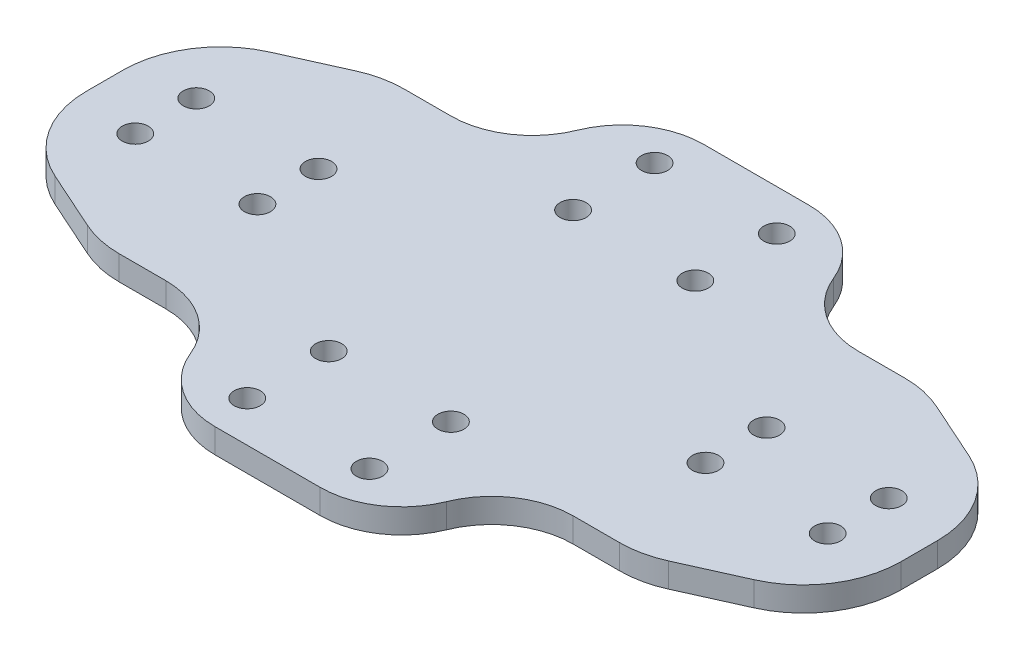
from build123d import *

# Parameters (mm, degrees)
SKETCH_2_W          = 30
SKETCH_2_H          = 60
SKETCH_2_R          = 1.6
EXTRUDE_1_DEPTH     = 3
SKETCH_3_W          = 100
SKETCH_3_H          = 35
SKETCH_3_W_2        = 28.612944684
SKETCH_3_H_2        = 33.572555392
EXTRUDE_2_DEPTH     = 3
SKETCH_4_R          = 1.6
CUT_EXTRUDE_1_DEPTH = 59.386642308
SKETCH_6_OUTSIDE_W  = 125.332
SKETCH_6_OUTSIDE_H  = 85.332
CUT_EXTRUDE_2_DEPTH = 59.386642308
FILLET_3_R          = 10
FILLET_4_R          = 10
FILLET_5_R          = 12
FILLET_6_R          = 12


with BuildPart() as part:
    # 草图2 → 凸台-拉伸1 (new body)
    with BuildSketch(Plane(origin=(0, 0, 0), x_dir=(1, 0, 0), z_dir=(0, 1, 0))):
        Rectangle(SKETCH_2_W, SKETCH_2_H)
        with Locations(Location((-7.5, -15, 0), (0, 0, 270))):
            Circle(SKETCH_2_R, mode=Mode.SUBTRACT)
        with Locations(Location((7.5, -15, 0), (0, 0, 270))):
            Circle(SKETCH_2_R, mode=Mode.SUBTRACT)
        with Locations(Location((7.5, 15, 0), (0, 0, 270))):
            Circle(SKETCH_2_R, mode=Mode.SUBTRACT)
        with Locations(Location((7.5, 25, 0), (0, 0, 270))):
            Circle(SKETCH_2_R, mode=Mode.SUBTRACT)
        with Locations(Location((-7.5, 15, 0), (0, 0, 270))):
            Circle(SKETCH_2_R, mode=Mode.SUBTRACT)
        with Locations(Location((-7.5, 25, 0), (0, 0, 270))):
            Circle(SKETCH_2_R, mode=Mode.SUBTRACT)
        with Locations(Location((7.5, -25, 0), (0, 0, 270))):
            Circle(SKETCH_2_R, mode=Mode.SUBTRACT)
        with Locations(Location((-7.5, -25, 0), (0, 0, 270))):
            Circle(SKETCH_2_R, mode=Mode.SUBTRACT)
    extrude(amount=EXTRUDE_1_DEPTH)

    # 草图3 → 凸台-拉伸2 (add)
    with BuildSketch(Plane.XZ):
        Rectangle(SKETCH_3_W, SKETCH_3_H)
        Rectangle(SKETCH_3_W_2, SKETCH_3_H_2, mode=Mode.SUBTRACT)
    extrude(amount=-EXTRUDE_2_DEPTH)

    # 草图4 → 切除-拉伸1 (cut, through all)
    with BuildSketch(Plane.XZ):
        with Locations(Location((-42.5, 3.75, 0), (0, 0, 270))):
            Circle(SKETCH_4_R)
        with Locations(Location((-42.5, -3.75, 0), (0, 0, 90))):
            Circle(SKETCH_4_R)
        with Locations(Location((-27.5, -3.75, 0), (0, 0, 270))):
            Circle(SKETCH_4_R)
        with Locations(Location((-27.5, 3.75, 0), (0, 0, 90))):
            Circle(SKETCH_4_R)
        with Locations(Location((42.5, 3.75, 0), (0, 0, 90))):
            Circle(SKETCH_4_R)
        with Locations(Location((42.5, -3.75, 0), (0, 0, 270))):
            Circle(SKETCH_4_R)
        with Locations(Location((27.5, -3.75, 0), (0, 0, 90))):
            Circle(SKETCH_4_R)
        with Locations(Location((27.5, 3.75, 0), (0, 0, 270))):
            Circle(SKETCH_4_R)
    extrude(amount=-CUT_EXTRUDE_1_DEPTH, mode=Mode.SUBTRACT)

    # 草图6 outside → 切除-拉伸2 (cut, through all)
    with BuildSketch(Plane(origin=(0, 3, 0), x_dir=(1, 0, 0), z_dir=(0, 1, 0))):
        Rectangle(SKETCH_6_OUTSIDE_W, SKETCH_6_OUTSIDE_H)
        Polygon((-15, 30), (-23.291561976, 17.5), (-33.291561976, 17.5), (-50, 10), (-50, -10), (-33.291561976, -17.5), (-23.291561976, -17.5), (-15, -30), (15, -30), (23.291561976, -17.5), (33.291561976, -17.5), (50, -10), (50, 10), (33.291561976, 17.5), (23.291561976, 17.5), (15, 30), align=None, mode=Mode.SUBTRACT)
    extrude(amount=-CUT_EXTRUDE_2_DEPTH, mode=Mode.SUBTRACT)

    # 圆角3
    fillet_3_edges = [part.edges().sort_by_distance(p)[0] for p in [
        (15, 1.5, -17.5),
        (15, 1.5, 17.5),
        (-15, 1.5, -17.5),
        (-15, 1.5, 17.5),
    ]]
    fillet(fillet_3_edges, radius=FILLET_3_R)

    # 圆角4
    fillet_4_edges = [part.edges().sort_by_distance(p)[0] for p in [
        (-15, 1.5, 30),
        (15, 1.5, 30),
        (15, 1.5, -30),
        (-15, 1.5, -30),
    ]]
    fillet(fillet_4_edges, radius=FILLET_4_R)

    # 圆角5
    fillet_5_edges = [part.edges().sort_by_distance(p)[0] for p in [
        (50, 1.5, -10),
        (50, 1.5, 10),
        (-50, 1.5, 10),
        (-50, 1.5, -10),
    ]]
    fillet(fillet_5_edges, radius=FILLET_5_R)

    # 圆角6
    fillet_6_edges = [part.edges().sort_by_distance(p)[0] for p in [
        (33.291561976, 1.5, -17.5),
        (33.291561976, 1.5, 17.5),
        (-33.291561976, 1.5, 17.5),
        (-33.291561976, 1.5, -17.5),
    ]]
    fillet(fillet_6_edges, radius=FILLET_6_R)


solid = part.part
